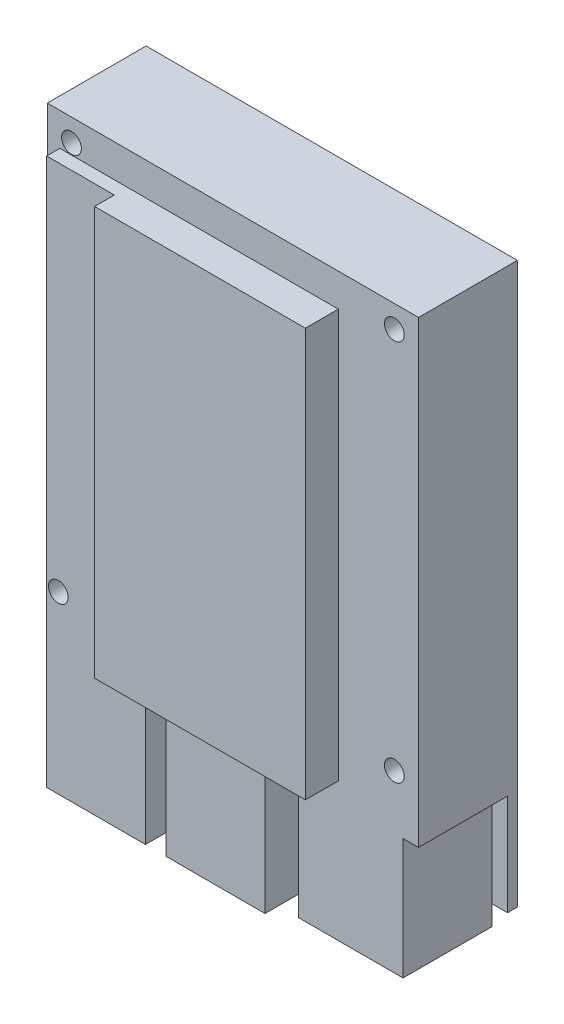
from build123d import *

# Parameters (mm, degrees)
SKETCH1_W           = 56.35
SKETCH1_H           = 85
BOSS_EXTRUDE1_DEPTH = 55.5
CUT_EXTRUDE3_DEPTH  = 117.105867638
CUT_EXTRUDE4_DEPTH  = 18
SKETCH2_4_W         = 10.275
SKETCH2_4_H         = 15.5
SKETCH2_4_W_2       = 4.725
SKETCH2_4_W_3       = 15
SKETCH2_4_W_4       = 6.075
SKETCH2_4_H_2       = 13.5
SKETCH2_4_W_5       = 9.825
BOSS_EXTRUDE2_DEPTH = 3
SKETCH3_W           = 6.5
SKETCH3_H           = 52.5
BOSS_EXTRUDE3_DEPTH = 2.4
SKETCH4_W           = 83.236605227
SKETCH4_H           = 41.384754339
CUT_EXTRUDE5_DEPTH  = 117.105867638
SKETCH6_W           = 56.35
SKETCH6_H           = 69.665906653
BOSS_EXTRUDE4_DEPTH = 13.5
SKETCH5_R           = 1.5
CUT_EXTRUDE6_DEPTH  = 104.924600071
SKETCH7_W           = 101.583675899
SKETCH7_H           = 36.04582048
CUT_EXTRUDE7_DEPTH  = 5


with BuildPart() as part:
    # Sketch1 → Boss-Extrude1 (new body)
    with BuildSketch(Plane.XY):
        with Locations((28.175, 42.5)):
            Rectangle(SKETCH1_W, SKETCH1_H)
    extrude(amount=BOSS_EXTRUDE1_DEPTH)

    # Sketch2 → Cut-Extrude3 (cut, through all)
    with BuildSketch(Plane.XZ):
        with BuildLine():
            Line((5.575, 25.1), (0, 25.1))
            Line((0, 25.1), (0, 0))
            Line((0, 0), (11.575, 0))
            ThreePointArc((11.575, 0), (7.332359313, 1.757359313), (5.575, 6))
            Line((5.575, 6), (5.575, 25.1))
        make_face()
        with BuildLine():
            Line((56.35, 0), (56.35, 25.1))
            Line((56.35, 25.1), (50.775, 25.1))
            Line((50.775, 25.1), (50.775, 6))
            ThreePointArc((50.775, 6), (49.017640687, 1.757359313), (44.775, 0))
            Line((44.775, 0), (56.35, 0))
        make_face()
        Polygon((56.35, 55.5), (44.175, 55.5), (44.175, 50.5), (54, 50.5), (54, 37), (56.35, 37), align=None)
        Polygon((1.9, 37), (1.9, 52.5), (12.175, 52.5), (12.175, 55.5), (0, 55.5), (0, 37), align=None)
    extrude(amount=-CUT_EXTRUDE3_DEPTH, mode=Mode.SUBTRACT)

    # Sketch2<3> → Cut-Extrude4 (cut)
    with BuildSketch(Plane.XZ):
        Polygon((12.175, 55.5), (12.175, 52.5), (16.9, 52.5), (16.9, 37), (20.05, 37), (20.05, 52.5), (35.05, 52.5), (35.05, 37), (38.1, 37), (38.1, 50.5), (44.175, 50.5), (44.175, 55.5), align=None)
    extrude(amount=-CUT_EXTRUDE4_DEPTH, mode=Mode.SUBTRACT)

    # Sketch2<4> → Boss-Extrude2 (add)
    with BuildSketch(Plane.XZ):
        with Locations((7.0375, 44.75)):
            Rectangle(SKETCH2_4_W, SKETCH2_4_H)
        with Locations((14.5375, 44.75)):
            Rectangle(SKETCH2_4_W_2, SKETCH2_4_H)
        with Locations((27.55, 44.75)):
            Rectangle(SKETCH2_4_W_3, SKETCH2_4_H)
        with Locations((41.1375, 43.75)):
            Rectangle(SKETCH2_4_W_4, SKETCH2_4_H_2)
        with Locations((49.0875, 43.75)):
            Rectangle(SKETCH2_4_W_5, SKETCH2_4_H_2)
    extrude(amount=BOSS_EXTRUDE2_DEPTH)

    # Sketch3 → Boss-Extrude3 (add)
    with BuildSketch(Plane.ZY.offset(-1.9)):
        with Locations((40.25, 53.45)):
            Rectangle(SKETCH3_W, SKETCH3_H)
        with Locations((29.75, 53.45)):
            Rectangle(SKETCH3_W, SKETCH3_H)
    extrude(amount=BOSS_EXTRUDE3_DEPTH)

    # Sketch4 → Cut-Extrude5 (cut, through all)
    with BuildSketch(Plane.XZ):
        with Locations((28.392096551, 14.80762283)):
            Rectangle(SKETCH4_W, SKETCH4_H)
    extrude(amount=-CUT_EXTRUDE5_DEPTH, mode=Mode.SUBTRACT)

    # Sketch6 → Boss-Extrude4 (add)
    with BuildSketch(Plane.XY.offset(50.5)):
        with Locations((28.175, 50.167046674)):
            Rectangle(SKETCH6_W, SKETCH6_H)
    extrude(amount=-BOSS_EXTRUDE4_DEPTH)

    # Sketch5 → Cut-Extrude6 (cut, through all)
    with BuildSketch(Plane(origin=(0, 0, 35.5), x_dir=(-1, 0, 0), z_dir=(0, 0, -1))):
        with Locations((-52.675, 81.6)):
            Circle(SKETCH5_R)
        with Locations((-3.675, 81.6)):
            Circle(SKETCH5_R)
        with Locations((-3.675, 23.6)):
            Circle(SKETCH5_R)
        with Locations((-52.675, 23.6)):
            Circle(SKETCH5_R)
    extrude(amount=-CUT_EXTRUDE6_DEPTH, mode=Mode.SUBTRACT)

    # Sketch7 → Cut-Extrude7 (cut)
    with BuildSketch(Plane.XY.offset(55.5)):
        with Locations((37.583210273, 98.02291024)):
            Rectangle(SKETCH7_W, SKETCH7_H)
    extrude(amount=-CUT_EXTRUDE7_DEPTH, mode=Mode.SUBTRACT)


solid = part.part
